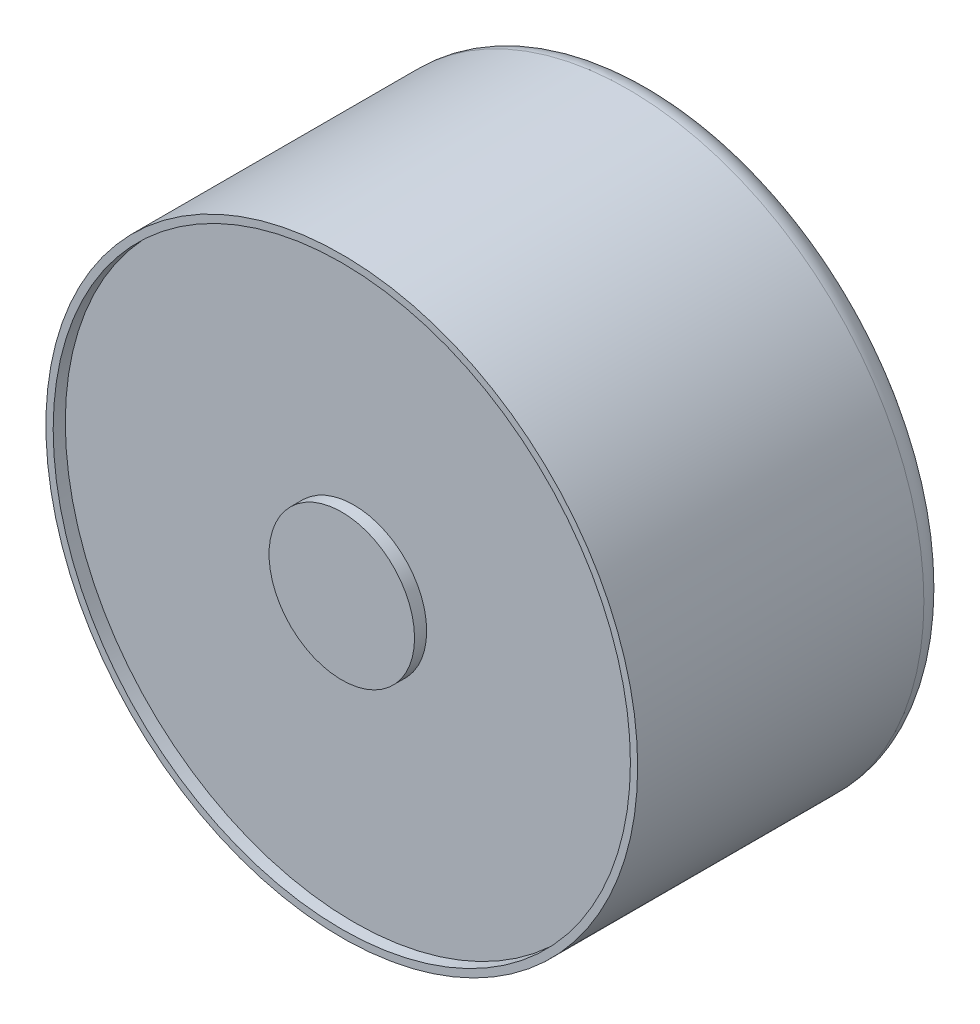
from build123d import *

# Parameters (mm, degrees)
SKETCH2_R           = 1
BOSS_EXTRUDE1_DEPTH = 6
CIRPATTERN1_COUNT   = 6


with BuildPart() as part:
    # Sketch1 → Revolve1 (revolve)
    with BuildSketch(Plane(origin=(0, 0, 0), x_dir=(1, 0, 0), z_dir=(0, 1, 0))):
        with BuildLine():
            Line((0, 0), (3, 0))
            Line((3, 0), (3, 0.5))
            Line((3, 0.5), (11.9, 0.5))
            Line((11.9, 0.5), (11.9, 0))
            Line((11.9, 0), (12.2, 0))
            Line((12.2, 0), (12.2, 11.8))
            ThreePointArc((12.2, 11.8), (11.907106781, 12.507106781), (11.2, 12.8))
            Line((11.2, 12.8), (3, 12.8))
            Line((3, 12.8), (3, 13.3))
            Line((3, 13.3), (0, 13.3))
            Line((0, 13.3), (0, 0))
        make_face()
    revolve(axis=Axis((0, 0, 0), (0, 0, -1)))

    # Sketch2 → Boss-Extrude1 (add)
    with BuildSketch(Plane(origin=(0, 0, -13.3), x_dir=(-1, 0, 0), z_dir=(0, 0, -1))):
        Circle(SKETCH2_R)
    extrude(amount=BOSS_EXTRUDE1_DEPTH)

    # Sketch4 → M1.6 Clearance Hole1 (revolve, cut)
    with BuildSketch(Plane(origin=(0, 8.25, -12.8), x_dir=(0, 1, 0), z_dir=(1, 0, 0))):
        Polygon((0, 0), (0, 3.600860619), (1, 3), (1, 0), align=None)
    m1_6_clearance_hole1 = revolve(axis=Axis((0, 8.25, -19.15), (0, 0, 1)), mode=Mode.SUBTRACT)

    # CirPattern1: M1.6 Clearance Hole1 ×6 about axis
    cirpattern1_axis = Axis((0, 0, 0), (0, 0, 1))
    for i in range(1, CIRPATTERN1_COUNT):
        add(m1_6_clearance_hole1.rotate(cirpattern1_axis, i * 360 / CIRPATTERN1_COUNT), mode=Mode.SUBTRACT)


solid = part.part
